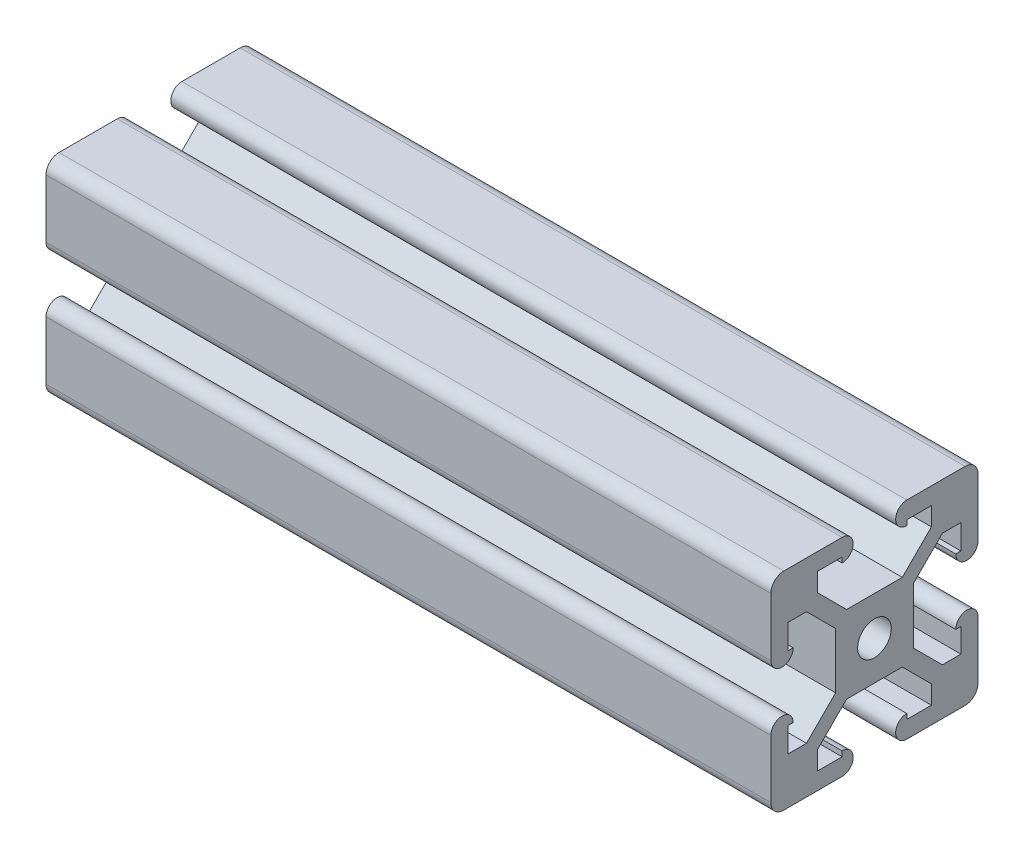
from build123d import *

# Parameters (mm, degrees)
SKETCH1_R           = 3.25
BOSS_EXTRUDE1_DEPTH = 140


with BuildPart() as part:
    # Sketch1 → Boss-Extrude1 (new body)
    with BuildSketch(Plane(origin=(0, 0, 0), x_dir=(0, 0, -1), z_dir=(1, 0, 0))):
        with BuildLine():
            Line((-20, 17.5), (-20, 6.25))
            ThreePointArc((-20, 6.25), (-17.85, 4.1), (-15.7, 6.25))
            Line((-15.7, 6.25), (-16.7, 6.25))
            Line((-16.7, 6.25), (-16.7, 11.005533085))
            Line((-16.7, 11.005533085), (-13.126853428, 11.005533085))
            Line((-13.126853428, 11.005533085), (-7.5, 5.378679656))
            Line((-7.5, 5.378679656), (-7.5, -5.378679656))
            Line((-7.5, -5.378679656), (-13.126853428, -11.005533085))
            Line((-13.126853428, -11.005533085), (-16.7, -11.005533085))
            Line((-16.7, -11.005533085), (-16.7, -6.25))
            Line((-16.7, -6.25), (-15.7, -6.25))
            ThreePointArc((-15.7, -6.25), (-17.85, -4.1), (-20, -6.25))
            Line((-20, -6.25), (-20, -17.5))
            ThreePointArc((-20, -17.5), (-19.267766953, -19.267766953), (-17.5, -20))
            Line((-17.5, -20), (-6.25, -20))
            ThreePointArc((-6.25, -20), (-4.1, -17.85), (-6.25, -15.7))
            Line((-6.25, -15.7), (-6.25, -16.7))
            Line((-6.25, -16.7), (-11.005533085, -16.7))
            Line((-11.005533085, -16.7), (-11.005533085, -13.126853428))
            Line((-11.005533085, -13.126853428), (-5.378679656, -7.5))
            Line((-5.378679656, -7.5), (5.378679656, -7.5))
            Line((5.378679656, -7.5), (11.005533085, -13.126853428))
            Line((11.005533085, -13.126853428), (11.005533085, -16.7))
            Line((11.005533085, -16.7), (6.25, -16.7))
            Line((6.25, -16.7), (6.25, -15.7))
            ThreePointArc((6.25, -15.7), (4.1, -17.85), (6.25, -20))
            Line((6.25, -20), (17.5, -20))
            ThreePointArc((17.5, -20), (19.267766953, -19.267766953), (20, -17.5))
            Line((20, -17.5), (20, -6.376005661))
            ThreePointArc((20, -6.376005661), (17.85, -4.226005661), (15.7, -6.376005661))
            Line((15.7, -6.376005661), (16.7, -6.376005661))
            Line((16.7, -6.376005661), (16.7, -11.005533085))
            Line((16.7, -11.005533085), (13.126853428, -11.005533085))
            Line((13.126853428, -11.005533085), (7.5, -5.378679656))
            Line((7.5, -5.378679656), (7.5, 5.378679656))
            Line((7.5, 5.378679656), (13.126853428, 11.005533085))
            Line((13.126853428, 11.005533085), (16.7, 11.005533085))
            Line((16.7, 11.005533085), (16.7, 6.25))
            Line((16.7, 6.25), (15.7, 6.25))
            ThreePointArc((15.7, 6.25), (17.85, 4.1), (20, 6.25))
            Line((20, 6.25), (20, 17.5))
            ThreePointArc((20, 17.5), (19.267766953, 19.267766953), (17.5, 20))
            Line((17.5, 20), (6.25, 20))
            ThreePointArc((6.25, 20), (4.1, 17.85), (6.25, 15.7))
            Line((6.25, 15.7), (6.25, 16.7))
            Line((6.25, 16.7), (11.005533085, 16.7))
            Line((11.005533085, 16.7), (11.005533085, 13.126853428))
            Line((11.005533085, 13.126853428), (5.378679656, 7.5))
            Line((5.378679656, 7.5), (-5.378679656, 7.5))
            Line((-5.378679656, 7.5), (-11.005533085, 13.126853428))
            Line((-11.005533085, 13.126853428), (-11.005533085, 16.7))
            Line((-11.005533085, 16.7), (-6.25, 16.7))
            Line((-6.25, 16.7), (-6.25, 15.7))
            ThreePointArc((-6.25, 15.7), (-4.1, 17.85), (-6.25, 20))
            Line((-6.25, 20), (-17.5, 20))
            ThreePointArc((-17.5, 20), (-19.267766953, 19.267766953), (-20, 17.5))
        make_face()
        Circle(SKETCH1_R, mode=Mode.SUBTRACT)
    extrude(amount=BOSS_EXTRUDE1_DEPTH)


solid = part.part
